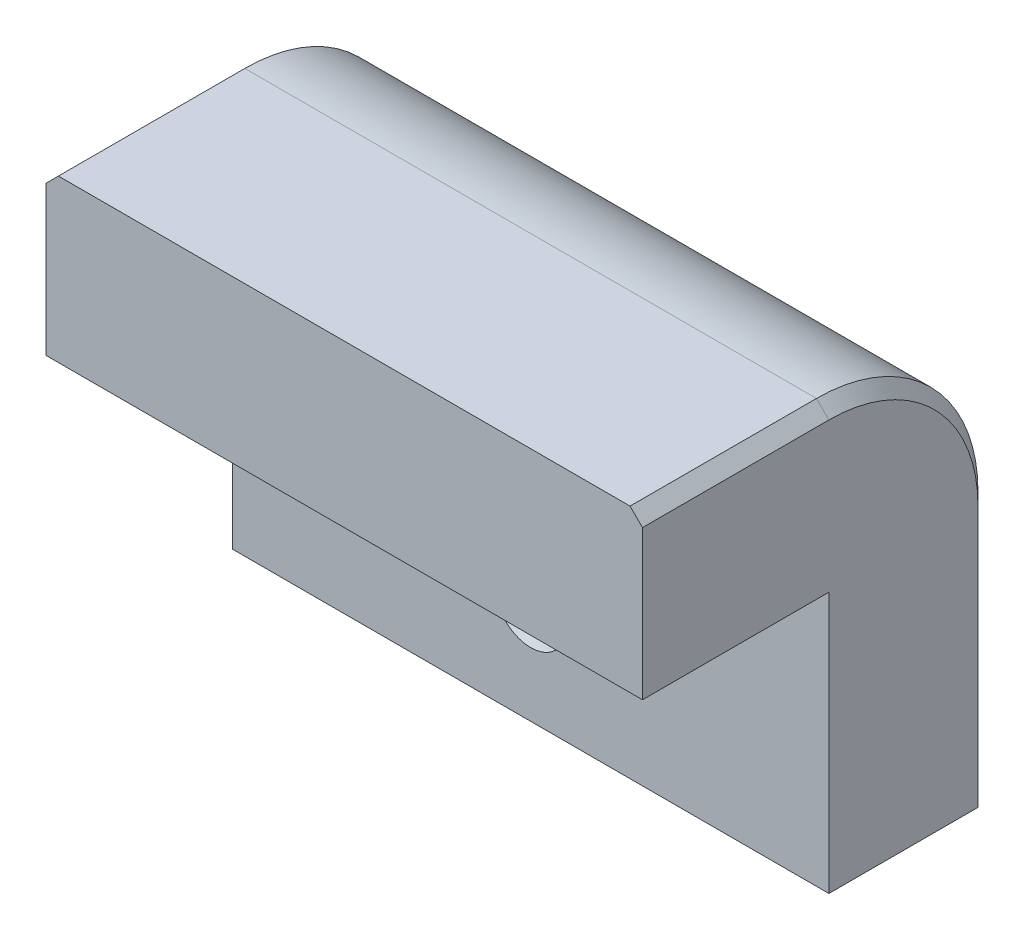
from build123d import *

# Parameters (mm, degrees)
SKETCH1_W           = 60.96
SKETCH1_H           = 16.51
SKETCH1_W_2         = 50.8
SKETCH1_H_2         = 6.35
BOSS_EXTRUDE1_DEPTH = 19.05
BOSS_EXTRUDE2_DEPTH = 60.96
SKETCH6_W           = 60.96
SKETCH6_H           = 16.51
SKETCH6_W_2         = 50.8
SKETCH6_H_2         = 6.35
BOSS_EXTRUDE3_DEPTH = 7.62
SKETCH7_W           = 50.8
SKETCH7_H           = 6.35
BOSS_EXTRUDE4_DEPTH = 7.62
SKETCH9_R           = 1.524
CUT_EXTRUDE1_DEPTH  = 51.561314263
CHAMFER1_SIZE       = 2.1082
CHAMFER1_SIZE2      = 1.832630301
SKETCH11_W          = 52.07
SKETCH11_H          = 7.62
CUT_EXTRUDE2_DEPTH  = 19.05
CHAMFER2_SIZE       = 1.27


with BuildPart() as part:
    # Sketch1 → Boss-Extrude1 (new body)
    with BuildSketch(Plane(origin=(0, 0, 0), x_dir=(1, 0, 0), z_dir=(0, 1, 0))):
        Rectangle(SKETCH1_W, SKETCH1_H)
        Rectangle(SKETCH1_W_2, SKETCH1_H_2, mode=Mode.SUBTRACT)
    extrude(amount=BOSS_EXTRUDE1_DEPTH)

    # Sketch5 → Boss-Extrude2 (add)
    with BuildSketch(Plane(origin=(30.48, 0, 0), x_dir=(0, 0, -1), z_dir=(1, 0, 0))):
        with BuildLine():
            Line((-8.255, 35.56), (-27.305, 35.56))
            Line((-27.305, 35.56), (-27.305, 19.05))
            Line((-27.305, 19.05), (-8.255, 19.05))
            Line((-8.255, 19.05), (8.255, 19.05))
            ThreePointArc((8.255, 19.05), (3.419332957, 30.724332957), (-8.255, 35.56))
        make_face()
    extrude(amount=-BOSS_EXTRUDE2_DEPTH)

    # Sketch6 → Boss-Extrude3 (add)
    with BuildSketch(Plane.XZ):
        Rectangle(SKETCH6_W, SKETCH6_H)
        Rectangle(SKETCH6_W_2, SKETCH6_H_2, mode=Mode.SUBTRACT)
    extrude(amount=BOSS_EXTRUDE3_DEPTH)

    # Sketch7 → Boss-Extrude4 (add)
    with BuildSketch(Plane.XZ.offset(-19.05)):
        Rectangle(SKETCH7_W, SKETCH7_H)
    extrude(amount=BOSS_EXTRUDE4_DEPTH)

    # Sketch9 → Cut-Extrude1 (cut, through all)
    with BuildSketch(Plane.XY.offset(8.255)):
        with Locations((0, 2.54)):
            Circle(SKETCH9_R)
    extrude(amount=-CUT_EXTRUDE1_DEPTH, mode=Mode.SUBTRACT)

    # Chamfer1
    chamfer1_edges = [part.edges().sort_by_distance(p)[0] for p in [
        (-1.524, 2.54, 8.255),
    ]]
    chamfer1_side = [part.faces().sort_by_distance(p)[0] for p in [
        (0, 5.729313606, 8.255),
    ]]
    chamfer(chamfer1_edges, length=CHAMFER1_SIZE, length2=CHAMFER1_SIZE2, reference=chamfer1_side[0])

    # Sketch11 → Cut-Extrude2 (cut)
    with BuildSketch(Plane.XZ.offset(7.62)):
        Rectangle(SKETCH11_W, SKETCH11_H)
    extrude(amount=-CUT_EXTRUDE2_DEPTH, mode=Mode.SUBTRACT)

    # Chamfer2
    chamfer2_edges = [part.edges().sort_by_distance(p)[0] for p in [
        (30.48, 30.724332957, -3.419332957),
        (30.48, 35.56, 17.78),
        (-30.48, 30.724332957, -3.419332957),
        (-30.48, 35.56, 17.78),
        (-30.48, 5.715, -8.255),
        (30.48, 5.715, -8.255),
    ]]
    chamfer(chamfer2_edges, length=CHAMFER2_SIZE)


solid = part.part
